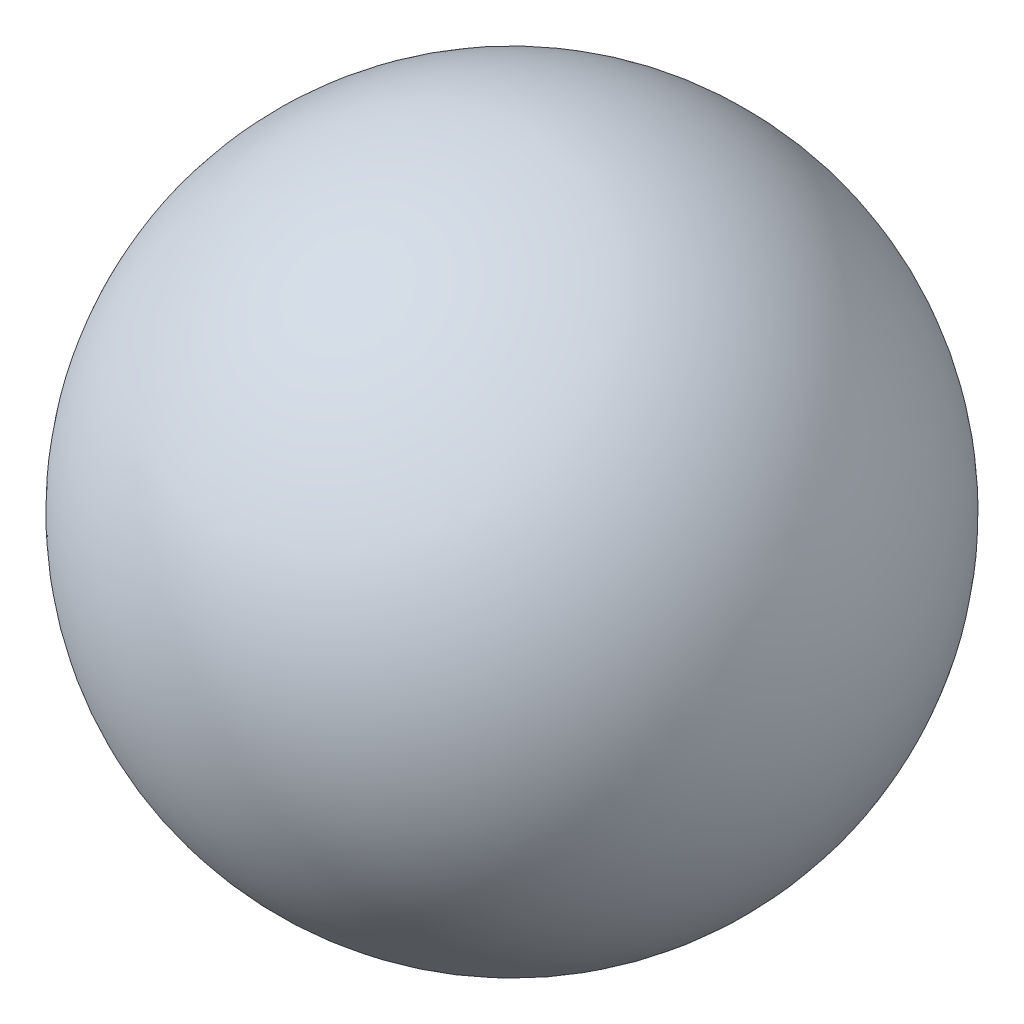
from build123d import *

# Parameters (mm, degrees)
SCALE1_SCALE = 0.2
SCALE2_SCALE = 1.9329
SCALE3_SCALE = 1.5


with BuildPart() as part:
    # Sketch1 → Revolve1 (revolve)
    with BuildSketch(Plane.XY):
        with BuildLine():
            Line((-12, 0), (12, 0))
            ThreePointArc((12, 0), (0, -12), (-12, 0))
        make_face()
    revolve(axis=Axis((-12, 0, 0), (1, 0, 0)))


with BuildPart() as part_1:
    # Scale1: scaled about (0, 0, 0)
    add(part.part.scale(SCALE1_SCALE))


with BuildPart() as part_2:
    # Scale2: scaled about (0, 0, 0)
    add(part_1.part.scale(SCALE2_SCALE))


with BuildPart() as part_3:
    # Scale3: scaled about (0, 0, 0)
    add(part_2.part.scale(SCALE3_SCALE))


solid = part_3.part
